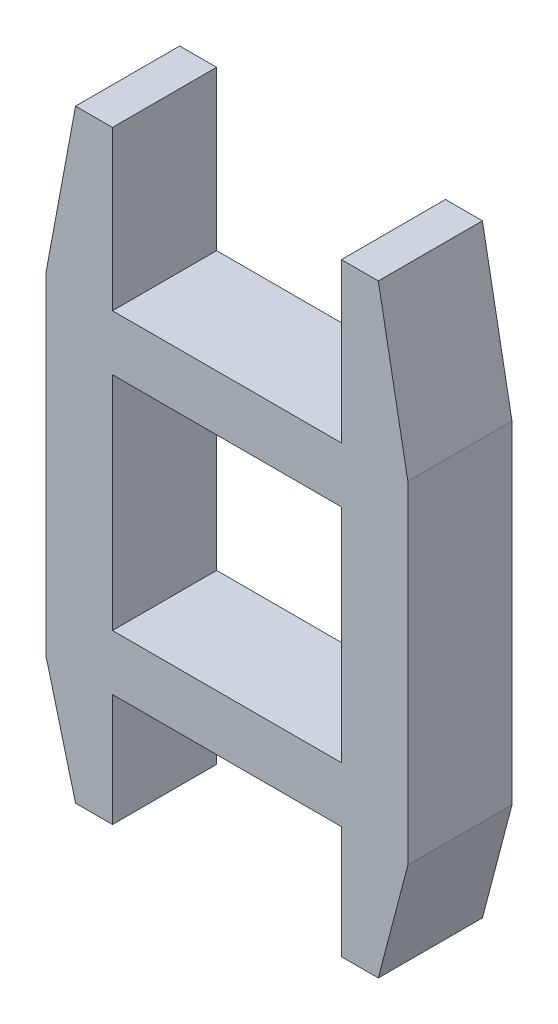
from build123d import *

# Parameters (mm, degrees)
SKETCH1_W           = 12.4
SKETCH1_H           = 12
BOSS_EXTRUDE1_DEPTH = 5.64


with BuildPart() as part:
    # Sketch1 → Boss-Extrude1 (new body)
    with BuildSketch(Plane.XY):
        Polygon((1245.209623553, 973.477195661), (1247.209623553, 973.477195661), (1247.209623553, 964.877195661), (1259.609623553, 964.877195661), (1259.609623553, 973.477195661), (1261.609623553, 973.477195661), (1263.209623553, 964.877195661), (1263.209623553, 946.877195661), (1261.609623553, 940.777195661), (1259.609623553, 940.777195661), (1259.609623553, 946.877195661), (1247.209623553, 946.877195661), (1247.209623553, 940.777195661), (1245.209623553, 940.777195661), (1243.609623553, 946.877195661), (1243.609623553, 964.877195661), align=None)
        with Locations((1253.409623553, 955.877195661)):
            Rectangle(SKETCH1_W, SKETCH1_H, mode=Mode.SUBTRACT)
    extrude(amount=BOSS_EXTRUDE1_DEPTH)


solid = part.part
